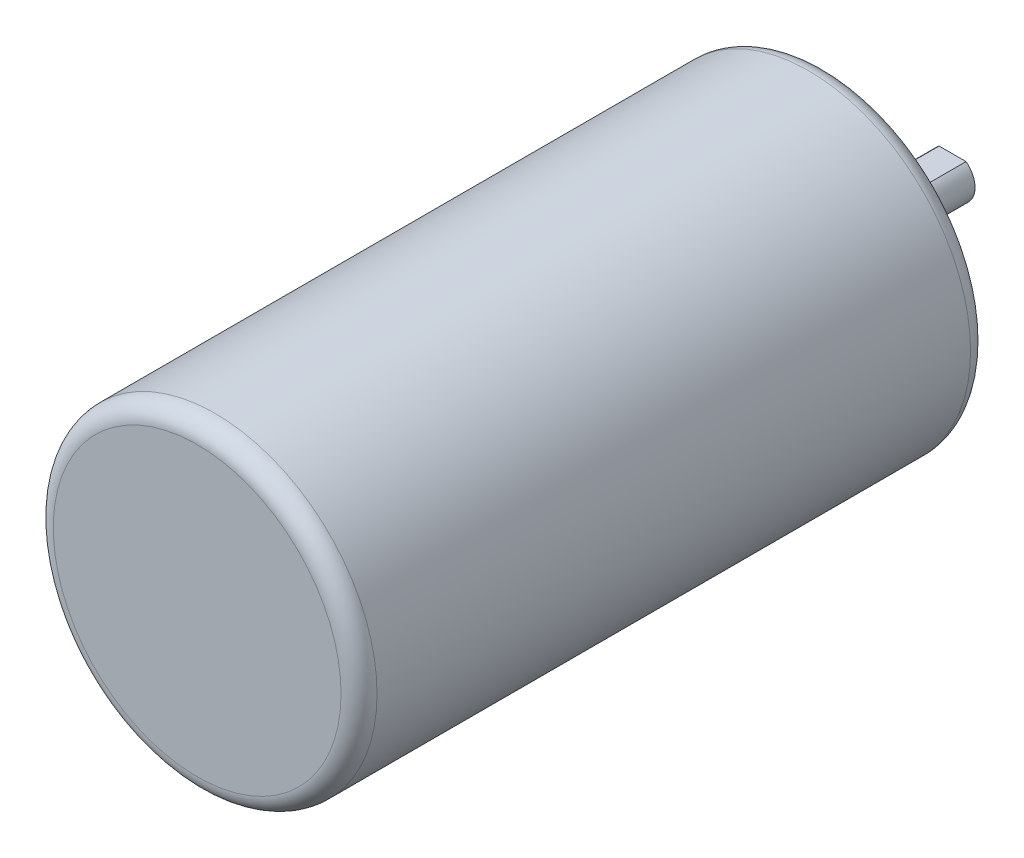
from build123d import *

# Parameters (mm, degrees)
SKETCH1_R           = 18
BOSS_EXTRUDE1_DEPTH = 70
BOSS_EXTRUDE2_DEPTH = 14
FILLET1_R           = 2


with BuildPart() as part:
    # Sketch1 → Boss-Extrude1 (new body)
    with BuildSketch(Plane.XY):
        Circle(SKETCH1_R)
    extrude(amount=BOSS_EXTRUDE1_DEPTH)

    # Sketch2 → Boss-Extrude2 (add)
    with BuildSketch(Plane(origin=(0, 0, 0), x_dir=(-1, 0, 0), z_dir=(0, 0, -1))):
        with BuildLine():
            Line((-1.5, 2), (1.5, 2))
            ThreePointArc((1.5, 2), (0, -2.5), (-1.5, 2))
        make_face()
    extrude(amount=BOSS_EXTRUDE2_DEPTH)

    # Fillet1
    fillet1_edges = [part.edges().sort_by_distance(p)[0] for p in [
        (-18, 0, 0),
        (-18, 0, 70),
    ]]
    fillet(fillet1_edges, radius=FILLET1_R)


solid = part.part
